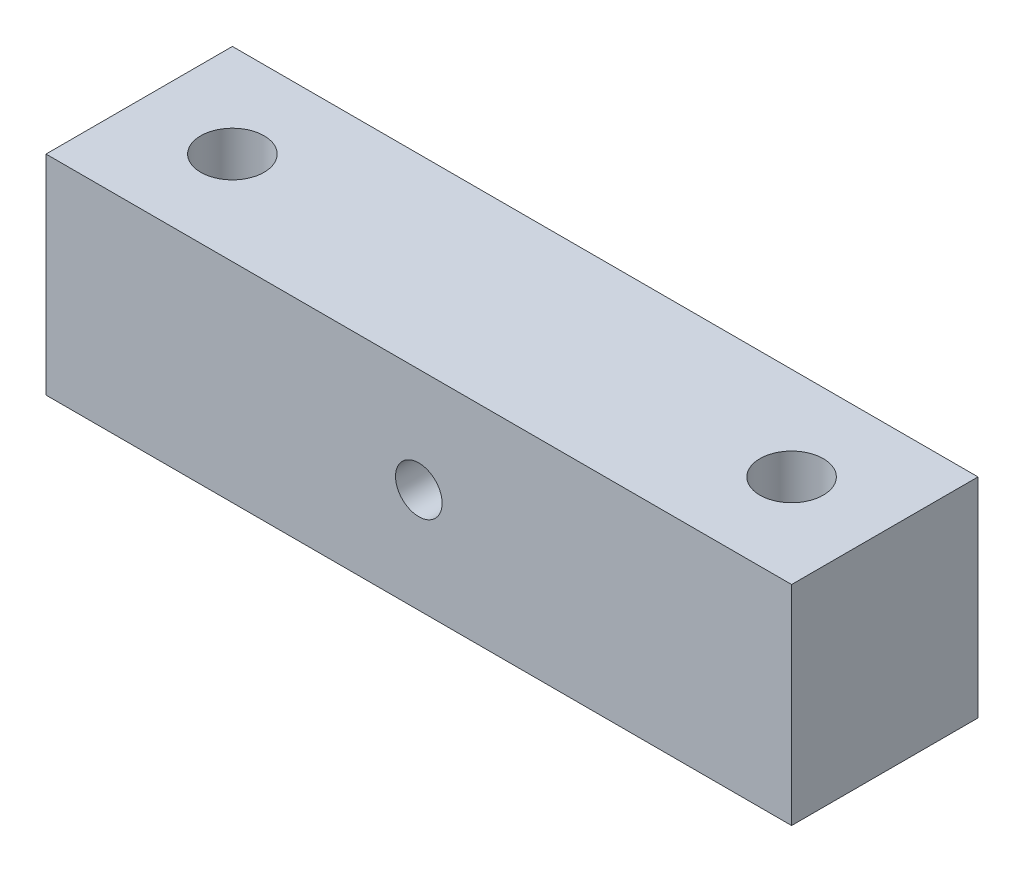
from build123d import *

# Parameters (mm, degrees)
SKETCH1_W             = 40
SKETCH1_H             = 10
BOSS_EXTRUDE1_DEPTH   = 11.2
M3_CLEARANCE_HOLE1_D  = 3.4
M3X0_5_TAPPED_HOLE1_D = 2.5


with BuildPart() as part:
    # Sketch1 → Boss-Extrude1 (new body)
    with BuildSketch(Plane(origin=(0, 0, 0), x_dir=(1, 0, 0), z_dir=(0, 1, 0))):
        with Locations((20, 5)):
            Rectangle(SKETCH1_W, SKETCH1_H)
    extrude(amount=BOSS_EXTRUDE1_DEPTH)

    # M3 Clearance Hole1 (through all)
    with Locations(Plane(origin=(5, 11.2, -5), x_dir=(0, 0, 1), z_dir=(0, 1, 0))):
        with Locations((0, 0), (0, 30)):
            Hole(M3_CLEARANCE_HOLE1_D / 2)

    # M3x0.5 Tapped Hole1 (through all)
    with Locations(Plane(origin=(20, 5.6, 0), x_dir=(1, 0, 0), z_dir=(0, 0, 1))):
        with Locations((0, 0)):
            Hole(M3X0_5_TAPPED_HOLE1_D / 2)


solid = part.part
